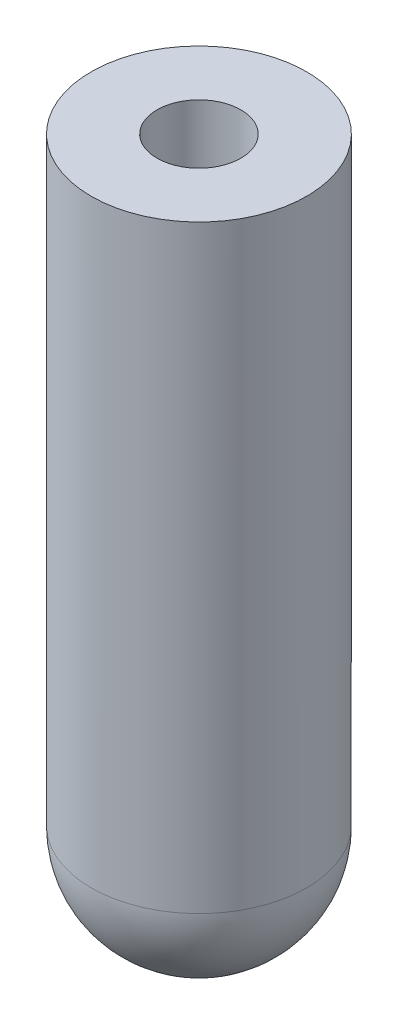
from build123d import *

# Parameters (mm, degrees)
SKETCH1_R           = 9
SKETCH1_R_2         = 3.5
BOSS_EXTRUDE1_DEPTH = 50
REVOLVE1_ANGLE      = 180


with BuildPart() as part:
    # Sketch1 → Boss-Extrude1 (new body)
    with BuildSketch(Plane(origin=(0, 0, 0), x_dir=(1, 0, 0), z_dir=(0, 1, 0))):
        with Locations(Location((0, 0, 0), (0, 0, 270))):
            Circle(SKETCH1_R)
        with Locations(Location((0, 0, 0), (0, 0, 270))):
            Circle(SKETCH1_R_2, mode=Mode.SUBTRACT)
    extrude(amount=-BOSS_EXTRUDE1_DEPTH)

    # Sketch2 → Revolve1 (revolve)
    with BuildSketch(Plane(origin=(0, -50, 0), x_dir=(-1, 0, 0), z_dir=(0, -1, 0))):
        with BuildLine():
            Line((0, -9), (0, 9))
            ThreePointArc((0, 9), (-9, 0), (0, -9))
        make_face()
    revolve(axis=Axis((0, -50, 9), (0, 0, -1)), revolution_arc=REVOLVE1_ANGLE)


solid = part.part
